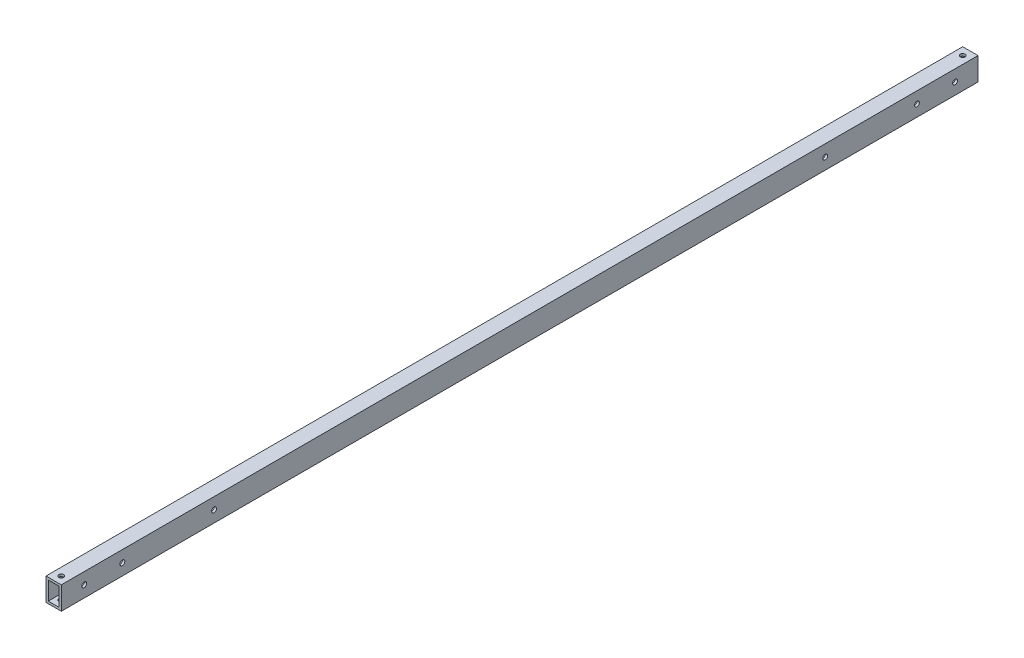
from build123d import *

# Parameters (mm, degrees)
SKETCH_1_W          = 10
SKETCH_1_H          = 15
SKETCH_1_W_2        = 7
SKETCH_1_H_2        = 12
EXTRUDE_1_DEPTH     = 600
SKETCH_2_R          = 1.6
CUT_EXTRUDE_1_DEPTH = 601.208297177
SKETCH_3_R          = 1.6
CUT_EXTRUDE_2_DEPTH = 601.130194208


with BuildPart() as part:
    # ｽｹｯﾁ1 → 押し出し-薄板1 (new body)
    with BuildSketch(Plane.XY):
        Rectangle(SKETCH_1_W, SKETCH_1_H)
        Rectangle(SKETCH_1_W_2, SKETCH_1_H_2, mode=Mode.SUBTRACT)
    extrude(amount=EXTRUDE_1_DEPTH)

    # ｽｹｯﾁ2 → ｶｯﾄ - 押し出し1 (cut, through all)
    with BuildSketch(Plane(origin=(0, 7.5, 0), x_dir=(1, 0, 0), z_dir=(0, 1, 0))):
        with Locations(Location((0, -595, 0), (0, 0, 270))):
            Circle(SKETCH_2_R)
        with Locations(Location((0, -5, 0), (0, 0, 270))):
            Circle(SKETCH_2_R)
    extrude(amount=-CUT_EXTRUDE_1_DEPTH, mode=Mode.SUBTRACT)

    # ｽｹｯﾁ3 → ｶｯﾄ - 押し出し2 (cut, through all)
    with BuildSketch(Plane(origin=(5, 0, 0), x_dir=(0, 0, -1), z_dir=(1, 0, 0))):
        with Locations((-560, 0)):
            Circle(SKETCH_3_R)
        with Locations((-40, 0)):
            Circle(SKETCH_3_R)
        with Locations((-500, 0)):
            Circle(SKETCH_3_R)
        with Locations((-100, 0)):
            Circle(SKETCH_3_R)
        with Locations((-585, 0)):
            Circle(SKETCH_3_R)
        with Locations((-15, 0)):
            Circle(SKETCH_3_R)
    extrude(amount=-CUT_EXTRUDE_2_DEPTH, mode=Mode.SUBTRACT)


solid = part.part
